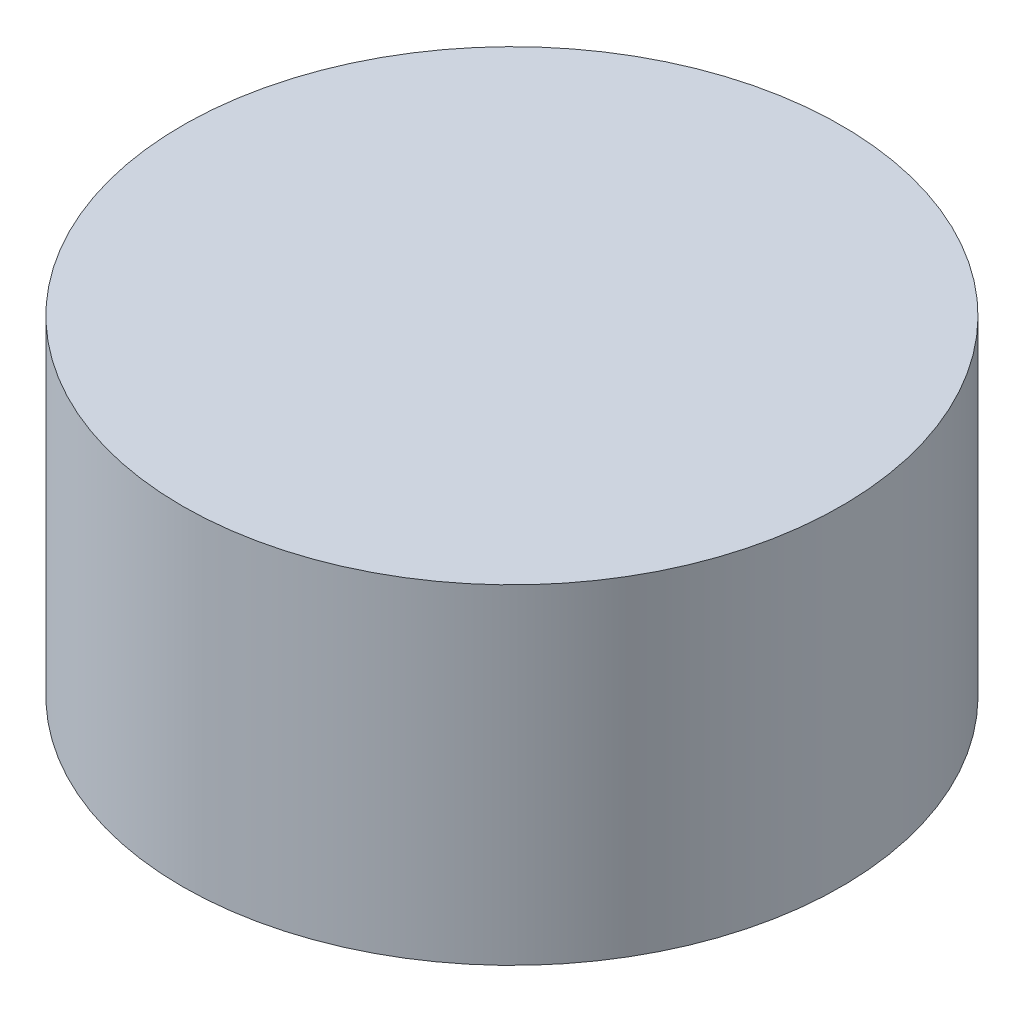
from build123d import *

# Parameters (mm, degrees)
SKETCH1_R           = 4
BOSS_EXTRUDE1_DEPTH = 2


with BuildPart() as part:
    # Sketch1 → Boss-Extrude1 (new, symmetric)
    with BuildSketch(Plane(origin=(0, 0, 0), x_dir=(1, 0, 0), z_dir=(0, 1, 0))):
        with Locations(Location((0, 0, 0), (0, 0, 270))):
            Circle(SKETCH1_R)
    extrude(amount=BOSS_EXTRUDE1_DEPTH, both=True)


solid = part.part
